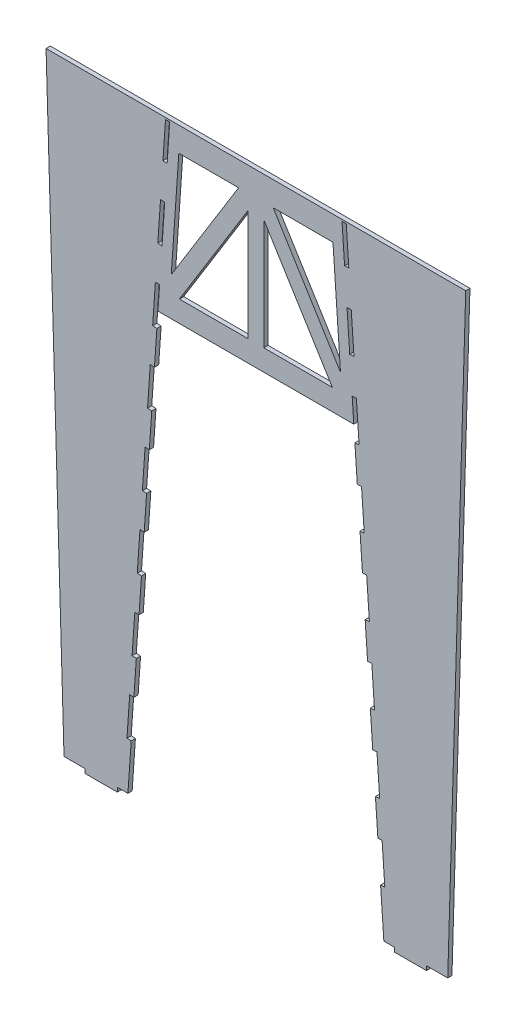
from build123d import *

# Parameters (mm, degrees)
BOSS_EXTRUDE1_DEPTH = 10.16
CUT_EXTRUDE5_DEPTH  = 12.7


with BuildPart() as part:
    # Sketch1 → Boss-Extrude1 (new body)
    with BuildSketch(Plane.XY):
        Polygon((-502.783260205, 1465.163333881), (-459.721789204, 17.476365817), (-408.921789204, 17.476365817), (-408.921789204, 7.316365817), (-332.100796745, 7.316365817), (-332.100796745, 17.476365817), (-306.627827519, 17.476365817), (-234.627172097, 1054.1), (234.627172097, 1054.1), (306.627827519, 17.476365817), (332.721789205, 17.476365817), (332.721789205, 7.316365817), (408.921789205, 7.316365817), (408.921789205, 17.476365817), (459.721789204, 17.476365817), (502.783260205, 1465.163333881), align=None)
        Polygon((183.241684323, 1104.9), (19.05, 1104.9), (19.05, 1370.513438368), align=None, mode=Mode.SUBTRACT)
        Polygon((-184.672467887, 1406.743333881), (-41.445883295, 1406.743333881), (-202.80261453, 1145.716008632), align=None, mode=Mode.SUBTRACT)
        Polygon((-19.05, 1370.513438368), (-19.05, 1104.9), (-183.241684323, 1104.9), align=None, mode=Mode.SUBTRACT)
        Polygon((184.672467887, 1406.743333881), (202.80261453, 1145.716008632), (41.445883295, 1406.743333881), align=None, mode=Mode.SUBTRACT)
    extrude(amount=BOSS_EXTRUDE1_DEPTH)

    # Sketch2 → Cut-Extrude5 (cut)
    with BuildSketch(Plane.XY):
        Polygon((-222.69422447, 1372.274878096), (-212.576544386, 1371.572135487), (-206.36877838, 1460.947946306), (-216.535268781, 1460.947946306), align=None)
        Polygon((-224.894455765, 1194.225999066), (-235.012135849, 1194.928741675), (-228.490407278, 1288.824803216), (-218.372727194, 1288.122060607), align=None)
        Polygon((224.894455765, 1194.225999066), (235.012135849, 1194.928741675), (228.490407278, 1288.824803216), (218.372727194, 1288.122060607), align=None)
        Polygon((212.576544386, 1371.572135487), (222.694224471, 1372.274878096), (216.535268781, 1460.947946306), (206.36877838, 1460.947946306), align=None)
        Polygon((-240.810161517, 1111.452134365), (-247.330047228, 1017.582605255), (-237.212367144, 1016.879862645), (-230.692481433, 1110.749391756), align=None)
        Polygon((237.212367144, 1016.879862645), (247.330047228, 1017.582605255), (240.810161517, 1111.452134365), (230.692481433, 1110.749391756), align=None)
        Polygon((-298.801924037, 130.149180543), (-292.291252627, 223.886047498), (-302.408932711, 224.588790108), (-308.919604121, 130.851923152), align=None)
        Polygon((-243.012235672, 933.376722904), (-253.129915756, 934.079465513), (-259.647958606, 840.236468834), (-249.530278522, 839.533726225), align=None)
        Polygon((243.012235672, 933.376722904), (253.129915756, 934.079465513), (259.647958606, 840.236468834), (249.530278522, 839.533726225), align=None)
        Polygon((-274.16610128, 484.841453384), (-284.283781364, 485.544195993), (-277.769424233, 579.334127811), (-267.651744149, 578.631385201), align=None)
        Polygon((-261.848189901, 662.187589804), (-271.965869985, 662.890332413), (-265.449669994, 756.706796662), (-255.33198991, 756.004054053), align=None)
        Polygon((261.848189901, 662.187589804), (271.965869985, 662.890332413), (265.449669994, 756.706796662), (255.33198991, 756.004054053), align=None)
        Polygon((274.16610128, 484.841453384), (284.283781364, 485.544195993), (277.769424233, 579.334127811), (267.651744149, 578.631385201), align=None)
        Polygon((-286.484012658, 307.495316963), (-296.601692742, 308.198059572), (-290.089178472, 401.961458959), (-279.971498388, 401.25871635), align=None)
        Polygon((286.484012658, 307.495316963), (296.601692742, 308.198059572), (290.089178472, 401.961458959), (279.971498388, 401.25871635), align=None)
        Polygon((298.801924037, 130.149180543), (308.919604121, 130.851923152), (302.408932711, 224.588790108), (292.291252627, 223.886047498), align=None)
    extrude(amount=CUT_EXTRUDE5_DEPTH, mode=Mode.SUBTRACT)


solid = part.part
